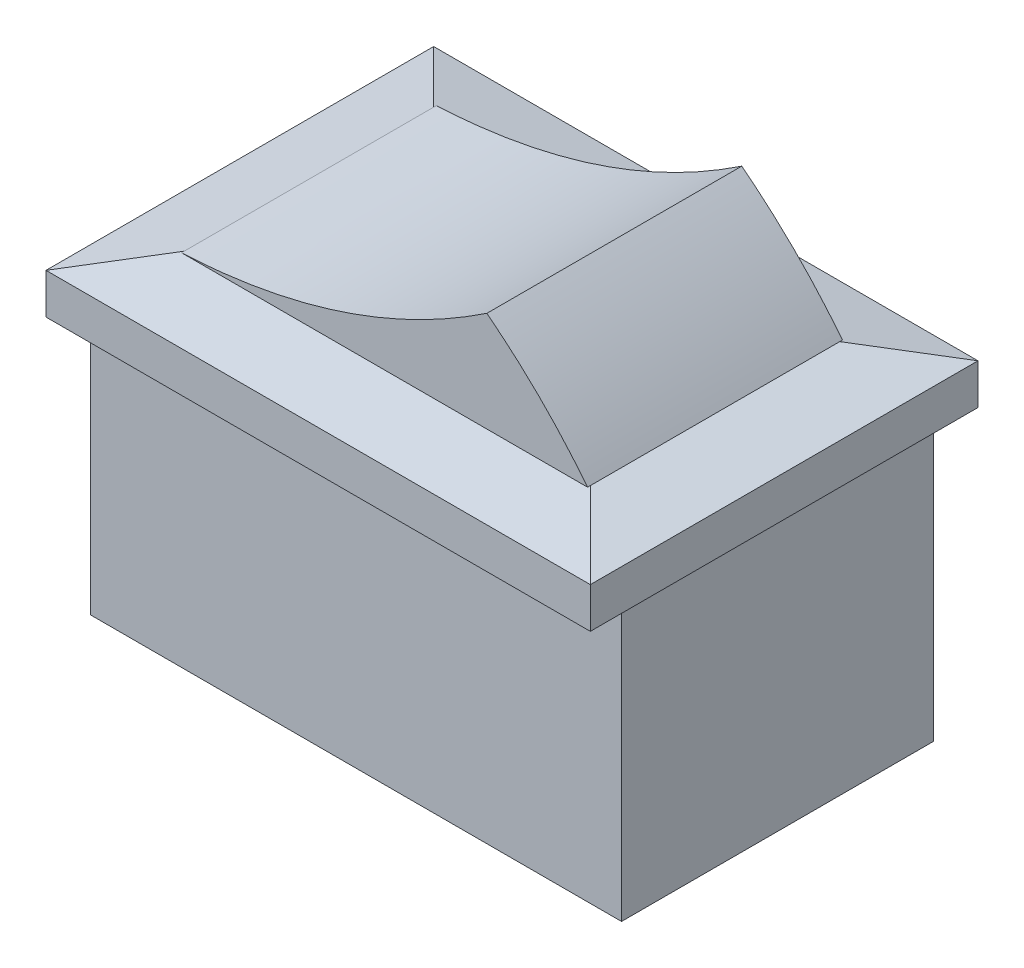
from build123d import *
from OCP.BRepFilletAPI import BRepFilletAPI_MakeChamfer

# Parameters (mm, degrees)
SKETCH1_W           = 20.32
SKETCH1_H           = 11.938
BOSS_EXTRUDE1_DEPTH = 10.4648
SKETCH2_W           = 20.828
SKETCH2_H           = 14.8336
BOSS_EXTRUDE2_DEPTH = 2.1844
CHAMFER1_SIZE       = 0.635
CHAMFER1_SIZE2      = 2.644965354
BOSS_EXTRUDE3_DEPTH = 4.8768


with BuildPart() as part:
    # Sketch1 → Boss-Extrude1 (new body)
    with BuildSketch(Plane(origin=(0, 0, 0), x_dir=(1, 0, 0), z_dir=(0, 1, 0))):
        Rectangle(SKETCH1_W, SKETCH1_H)
    extrude(amount=-BOSS_EXTRUDE1_DEPTH)

    # Sketch2 → Boss-Extrude2 (add)
    with BuildSketch(Plane(origin=(0, 0, 0), x_dir=(1, 0, 0), z_dir=(0, 1, 0))):
        Rectangle(SKETCH2_W, SKETCH2_H)
    extrude(amount=BOSS_EXTRUDE2_DEPTH)

    # Chamfer1: one chamfer whose edges measure the first distance from different faces: ONE call of the kernel's chamfer builder (chamfer() names one face for all edges)
    chamfer1_edges_1 = [part.edges().sort_by_distance(p)[0] for p in [
        (10.414, 2.1844, 0),
    ]]
    chamfer1_side_1 = [part.faces().sort_by_distance(p)[0] for p in [
        (10.414, 1.0922, 0),
    ]]
    chamfer1_edges_2 = [part.edges().sort_by_distance(p)[0] for p in [
        (0, 2.1844, -7.4168),
    ]]
    chamfer1_side_2 = [part.faces().sort_by_distance(p)[0] for p in [
        (0, 1.0922, -7.4168),
    ]]
    chamfer1_edges_3 = [part.edges().sort_by_distance(p)[0] for p in [
        (-10.414, 2.1844, 0),
    ]]
    chamfer1_side_3 = [part.faces().sort_by_distance(p)[0] for p in [
        (-10.414, 1.0922, 0),
    ]]
    chamfer1_edges_4 = [part.edges().sort_by_distance(p)[0] for p in [
        (0, 2.1844, 7.4168),
    ]]
    chamfer1_side_4 = [part.faces().sort_by_distance(p)[0] for p in [
        (0, 1.0922, 7.4168),
    ]]
    chamfer1 = BRepFilletAPI_MakeChamfer(part.part.solid().wrapped)
    for e in chamfer1_edges_1:
        chamfer1.Add(CHAMFER1_SIZE, CHAMFER1_SIZE2, e.wrapped, chamfer1_side_1[0].wrapped)  # the first distance lies on this face
    for e in chamfer1_edges_2:
        chamfer1.Add(CHAMFER1_SIZE, CHAMFER1_SIZE2, e.wrapped, chamfer1_side_2[0].wrapped)  # the first distance lies on this face
    for e in chamfer1_edges_3:
        chamfer1.Add(CHAMFER1_SIZE, CHAMFER1_SIZE2, e.wrapped, chamfer1_side_3[0].wrapped)  # the first distance lies on this face
    for e in chamfer1_edges_4:
        chamfer1.Add(CHAMFER1_SIZE, CHAMFER1_SIZE2, e.wrapped, chamfer1_side_4[0].wrapped)  # the first distance lies on this face
    add(Compound.cast(chamfer1.Shape()), mode=Mode.REPLACE)

    # Sketch11 → Boss-Extrude3 (add, symmetric)
    with BuildSketch(Plane.XY):
        with BuildLine():
            Line((-7.769034646, 2.1844), (7.769034646, 2.1844))
            add(Edge.make_bspline(
                [(3.914965354, 6.0198), (6.076533794, 4.336461904), (7.769034646, 2.1844)],
                knots=[0, 0, 0, 1, 1, 1], degree=2))
            add(Edge.make_bspline(
                [(-7.769034646, 2.1844), (-1.382026132, 2.477514442), (3.914965354, 6.0198)],
                knots=[0, 0, 0, 1, 1, 1], degree=2))
        make_face()
    extrude(amount=BOSS_EXTRUDE3_DEPTH, both=True)


solid = part.part
